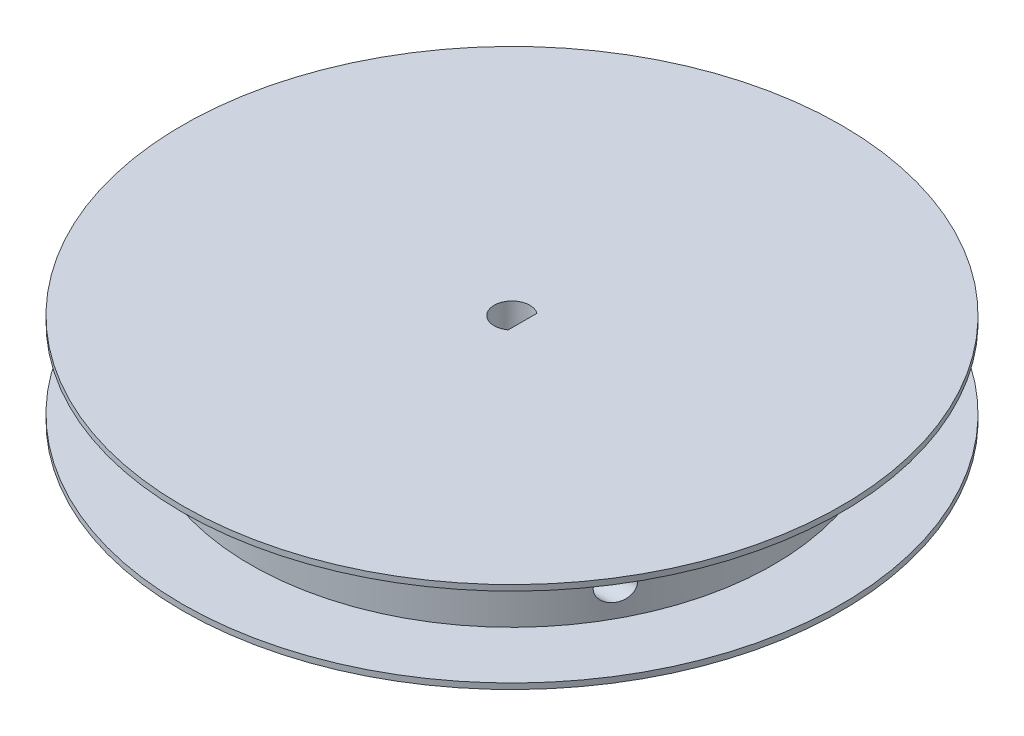
from build123d import *

# Parameters (mm, degrees)
SKETCH_1_R          = 9
EXTRUDE_1_DEPTH     = 8
CUT_EXTRUDE_1_DEPTH = 16.033296378
EXTRUDE_START       = -8
SKETCH_7_R          = 23
SKETCH_7_R_2        = 9
EXTRUDE_2_DEPTH     = 8
SKETCH_8_R          = 29
SKETCH_8_R_2        = 23
EXTRUDE_3_DEPTH     = 0.5
EXTRUDE_START_2     = -0.5
SKETCH_9_R          = 29
SKETCH_9_R_2        = 23
EXTRUDE_4_DEPTH     = 0.5
SKETCH_10_R         = 1.25977889
CUT_EXTRUDE_2_DEPTH = 25


with BuildPart() as part:
    # 草圖1 → 填料-伸長1 (new body)
    with BuildSketch(Plane(origin=(0, 0, 0), x_dir=(1, 0, 0), z_dir=(0, 1, 0))):
        with Locations(Location((0, 0, 0), (0, 0, 270))):
            Circle(SKETCH_1_R)
    extrude(amount=-EXTRUDE_1_DEPTH)

    # 草圖2 → 除料-伸長1 (cut, through all)
    with BuildSketch(Plane(origin=(0, -8, 0), x_dir=(-1, 0, 0), z_dir=(0, -1, 0))):
        with BuildLine():
            Line((-0.93, 1.264911064), (-0.93, -1.264911064))
            ThreePointArc((-0.93, -1.264911064), (0.708801806, -1.400892573), (1.57, 0))
            ThreePointArc((1.57, 0), (0.708801806, 1.400892573), (-0.93, 1.264911064))
        make_face()
    extrude(amount=-CUT_EXTRUDE_1_DEPTH, mode=Mode.SUBTRACT)

    # 草圖7 → 填料-伸長2 (add)
    with BuildSketch(Plane(origin=(0, -8, 0), x_dir=(-1, 0, 0), z_dir=(0, -1, 0)).offset(EXTRUDE_START)):
        with Locations(Location((0, 0, 0), (0, 0, 90))):
            Circle(SKETCH_7_R)
        Circle(SKETCH_7_R_2, mode=Mode.SUBTRACT)
    extrude(amount=EXTRUDE_2_DEPTH)

    # 草圖8 → 填料-伸長3 (add)
    with BuildSketch(Plane(origin=(0, 0, 0), x_dir=(1, 0, 0), z_dir=(0, 1, 0))):
        with Locations(Location((0, 0, 0), (0, 0, 270))):
            Circle(SKETCH_8_R)
        with Locations(Location((0, 0, 0), (0, 0, 90))):
            Circle(SKETCH_8_R_2, mode=Mode.SUBTRACT)
    extrude(amount=-EXTRUDE_3_DEPTH)

    # 草圖9 → 填料-伸長4 (add)
    with BuildSketch(Plane.XZ.offset(8).offset(EXTRUDE_START_2)):
        with Locations(Location((0, 0, 0), (0, 0, 90))):
            Circle(SKETCH_9_R)
        with Locations(Location((0, 0, 0), (0, 0, 270))):
            Circle(SKETCH_9_R_2, mode=Mode.SUBTRACT)
    extrude(amount=EXTRUDE_4_DEPTH)

    # 草圖10 → 除料-伸長2 (cut, symmetric)
    with BuildSketch(Plane(origin=(0, 0, 0), x_dir=(0, 0, -1), z_dir=(1, 0, 0))):
        with Locations((-11.0333289, -4.987601344)):
            Circle(SKETCH_10_R)
    extrude(amount=CUT_EXTRUDE_2_DEPTH, both=True, mode=Mode.SUBTRACT)


solid = part.part
